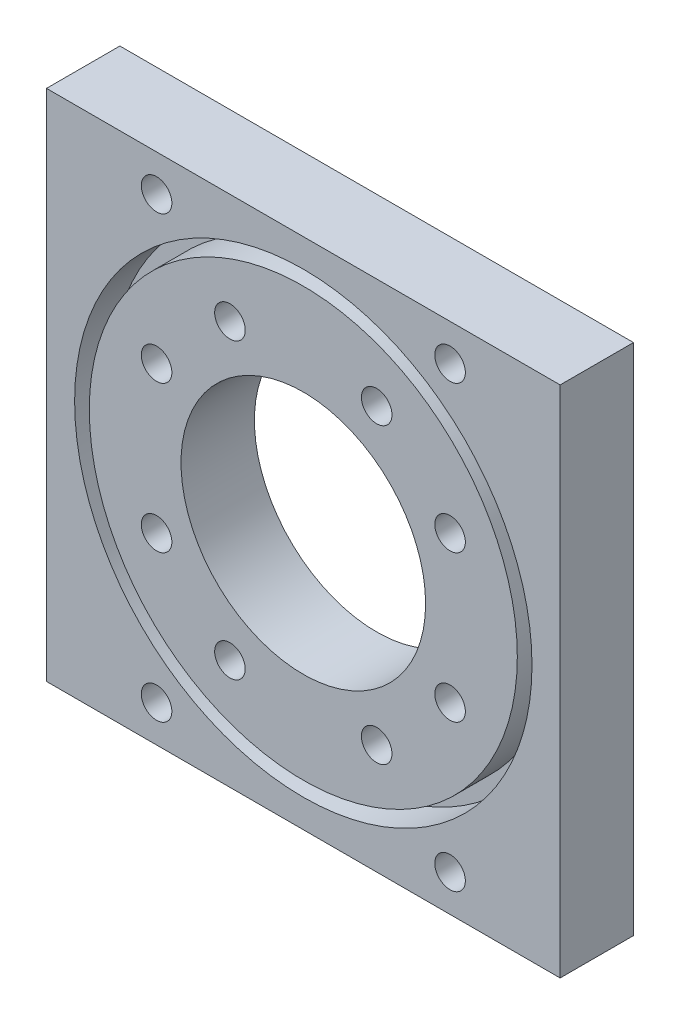
from build123d import *

# Parameters (mm, degrees)
SKETCH_1_W          = 42
SKETCH_1_H          = 42
SKETCH_1_R          = 1.25
SKETCH_1_R_2        = 10
EXTRUDE_1_DEPTH     = 6
SKETCH_2_R          = 18.7
SKETCH_2_R_2        = 17.5
CUT_EXTRUDE_1_DEPTH = 3


with BuildPart() as part:
    # 草圖1 → 填料-伸長1 (new body)
    with BuildSketch(Plane.XY):
        Rectangle(SKETCH_1_W, SKETCH_1_H)
        with Locations((-6, 12)):
            Circle(SKETCH_1_R, mode=Mode.SUBTRACT)
        with Locations((-12, 6)):
            Circle(SKETCH_1_R, mode=Mode.SUBTRACT)
        with Locations((-12, -6)):
            Circle(SKETCH_1_R, mode=Mode.SUBTRACT)
        with Locations((-6, -12)):
            Circle(SKETCH_1_R, mode=Mode.SUBTRACT)
        with Locations((6, 12)):
            Circle(SKETCH_1_R, mode=Mode.SUBTRACT)
        with Locations((12, 6)):
            Circle(SKETCH_1_R, mode=Mode.SUBTRACT)
        with Locations((12, -6)):
            Circle(SKETCH_1_R, mode=Mode.SUBTRACT)
        with Locations((6, -12)):
            Circle(SKETCH_1_R, mode=Mode.SUBTRACT)
        with Locations((-12, 18)):
            Circle(SKETCH_1_R, mode=Mode.SUBTRACT)
        with Locations((12, 18)):
            Circle(SKETCH_1_R, mode=Mode.SUBTRACT)
        with Locations((-12, -18)):
            Circle(SKETCH_1_R, mode=Mode.SUBTRACT)
        with Locations((12, -18)):
            Circle(SKETCH_1_R, mode=Mode.SUBTRACT)
        Circle(SKETCH_1_R_2, mode=Mode.SUBTRACT)
    extrude(amount=EXTRUDE_1_DEPTH)

    # 草圖2 → 除料-伸長1 (cut)
    with BuildSketch(Plane.XY.offset(6)):
        Circle(SKETCH_2_R)
        Circle(SKETCH_2_R_2, mode=Mode.SUBTRACT)
    extrude(amount=-CUT_EXTRUDE_1_DEPTH, mode=Mode.SUBTRACT)


solid = part.part
